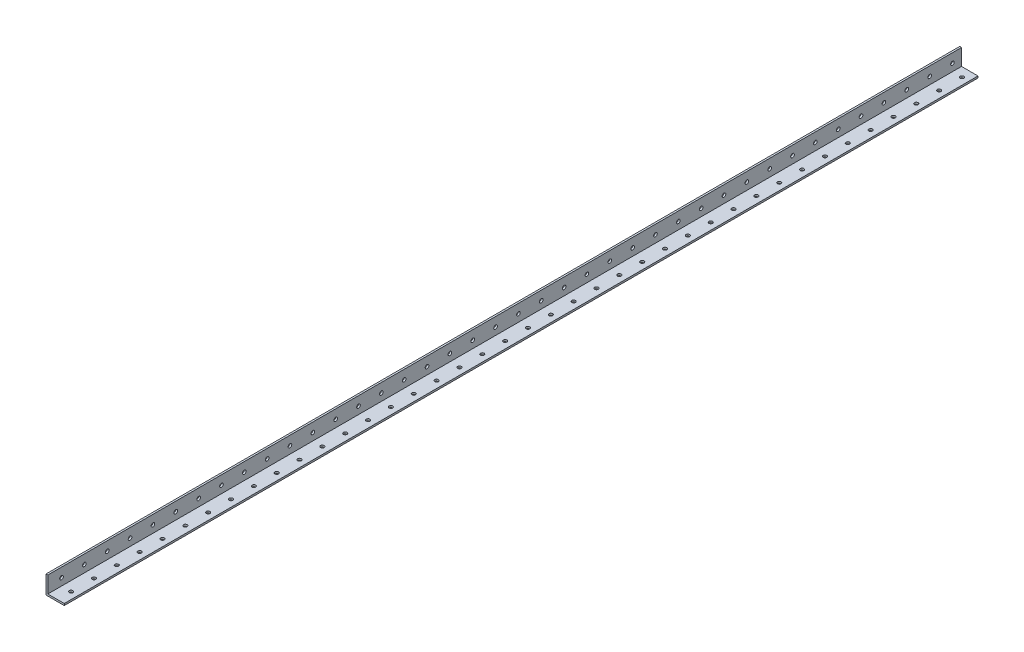
from build123d import *

# Parameters (mm, degrees)
SALIENTE_EXTRUIR1_DEPTH = 2000
CROQUIS2_R              = 4
CORTAR_EXTRUIR1_DEPTH   = 10
MATRIZL1_COUNT          = 40
MATRIZL1_PITCH          = 50
SKETCH1_R               = 4
CUT_EXTRUDE1_DEPTH      = 10


with BuildPart() as part:
    # Croquis1 → Saliente-Extruir1 (new body)
    with BuildSketch(Plane.XY):
        Polygon((0, 0), (0, 40), (4, 40), (4, 4), (40, 4), (40, 0), align=None)
    extrude(amount=SALIENTE_EXTRUIR1_DEPTH)

    # Croquis2 → Cortar-Extruir1 (cut)
    with BuildSketch(Plane(origin=(0, 4, 0), x_dir=(1, 0, 0), z_dir=(0, 1, 0))):
        with Locations(Location((25, -20, 0), (0, 0, 180))):
            Circle(CROQUIS2_R)
    cortar_extruir1 = extrude(amount=-CORTAR_EXTRUIR1_DEPTH, mode=Mode.SUBTRACT)

    # MatrizL1: Cortar-Extruir1 ×40
    with Locations(*[(0, 0, i * MATRIZL1_PITCH) for i in range(1, MATRIZL1_COUNT)]):
        add(cortar_extruir1, mode=Mode.SUBTRACT)

    # Sketch1 → Cut-Extrude1 (cut)
    with BuildSketch(Plane.ZY):
        with Locations((20, 20)):
            Circle(SKETCH1_R)
        with Locations((70, 20)):
            Circle(SKETCH1_R)
        with Locations((120, 20)):
            Circle(SKETCH1_R)
        with Locations((170, 20)):
            Circle(SKETCH1_R)
        with Locations((220, 20)):
            Circle(SKETCH1_R)
        with Locations((270, 20)):
            Circle(SKETCH1_R)
        with Locations((320, 20)):
            Circle(SKETCH1_R)
        with Locations((370, 20)):
            Circle(SKETCH1_R)
        with Locations((420, 20)):
            Circle(SKETCH1_R)
        with Locations((470, 20)):
            Circle(SKETCH1_R)
        with Locations((520, 20)):
            Circle(SKETCH1_R)
        with Locations((570, 20)):
            Circle(SKETCH1_R)
        with Locations((620, 20)):
            Circle(SKETCH1_R)
        with Locations((670, 20)):
            Circle(SKETCH1_R)
        with Locations((720, 20)):
            Circle(SKETCH1_R)
        with Locations((770, 20)):
            Circle(SKETCH1_R)
        with Locations((820, 20)):
            Circle(SKETCH1_R)
        with Locations((870, 20)):
            Circle(SKETCH1_R)
        with Locations((920, 20)):
            Circle(SKETCH1_R)
        with Locations((970, 20)):
            Circle(SKETCH1_R)
        with Locations((1020, 20)):
            Circle(SKETCH1_R)
        with Locations((1070, 20)):
            Circle(SKETCH1_R)
        with Locations((1120, 20)):
            Circle(SKETCH1_R)
        with Locations((1170, 20)):
            Circle(SKETCH1_R)
        with Locations((1220, 20)):
            Circle(SKETCH1_R)
        with Locations((1270, 20)):
            Circle(SKETCH1_R)
        with Locations((1320, 20)):
            Circle(SKETCH1_R)
        with Locations((1370, 20)):
            Circle(SKETCH1_R)
        with Locations((1420, 20)):
            Circle(SKETCH1_R)
        with Locations((1470, 20)):
            Circle(SKETCH1_R)
        with Locations((1520, 20)):
            Circle(SKETCH1_R)
        with Locations((1570, 20)):
            Circle(SKETCH1_R)
        with Locations((1620, 20)):
            Circle(SKETCH1_R)
        with Locations((1670, 20)):
            Circle(SKETCH1_R)
        with Locations((1720, 20)):
            Circle(SKETCH1_R)
        with Locations((1770, 20)):
            Circle(SKETCH1_R)
        with Locations((1820, 20)):
            Circle(SKETCH1_R)
        with Locations((1870, 20)):
            Circle(SKETCH1_R)
        with Locations((1920, 20)):
            Circle(SKETCH1_R)
        with Locations((1970, 20)):
            Circle(SKETCH1_R)
    extrude(amount=-CUT_EXTRUDE1_DEPTH, mode=Mode.SUBTRACT)


solid = part.part
